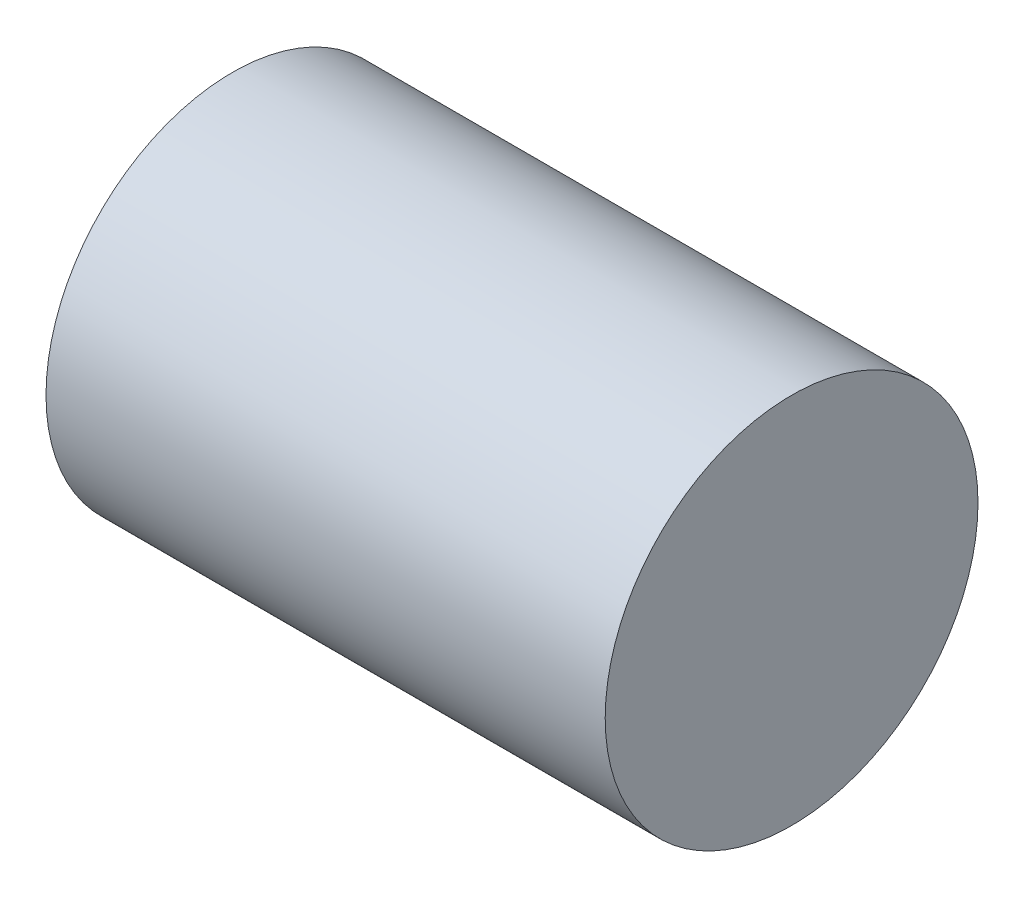
from build123d import *

# Parameters (mm, degrees)
SKETCH2_R           = 10
BOSS_EXTRUDE1_DEPTH = 30


with BuildPart() as part:
    # Sketch2 → Boss-Extrude1 (new body)
    with BuildSketch(Plane(origin=(0, 0, 0), x_dir=(0, 0, -1), z_dir=(1, 0, 0))):
        Circle(SKETCH2_R)
    extrude(amount=-BOSS_EXTRUDE1_DEPTH)


solid = part.part
